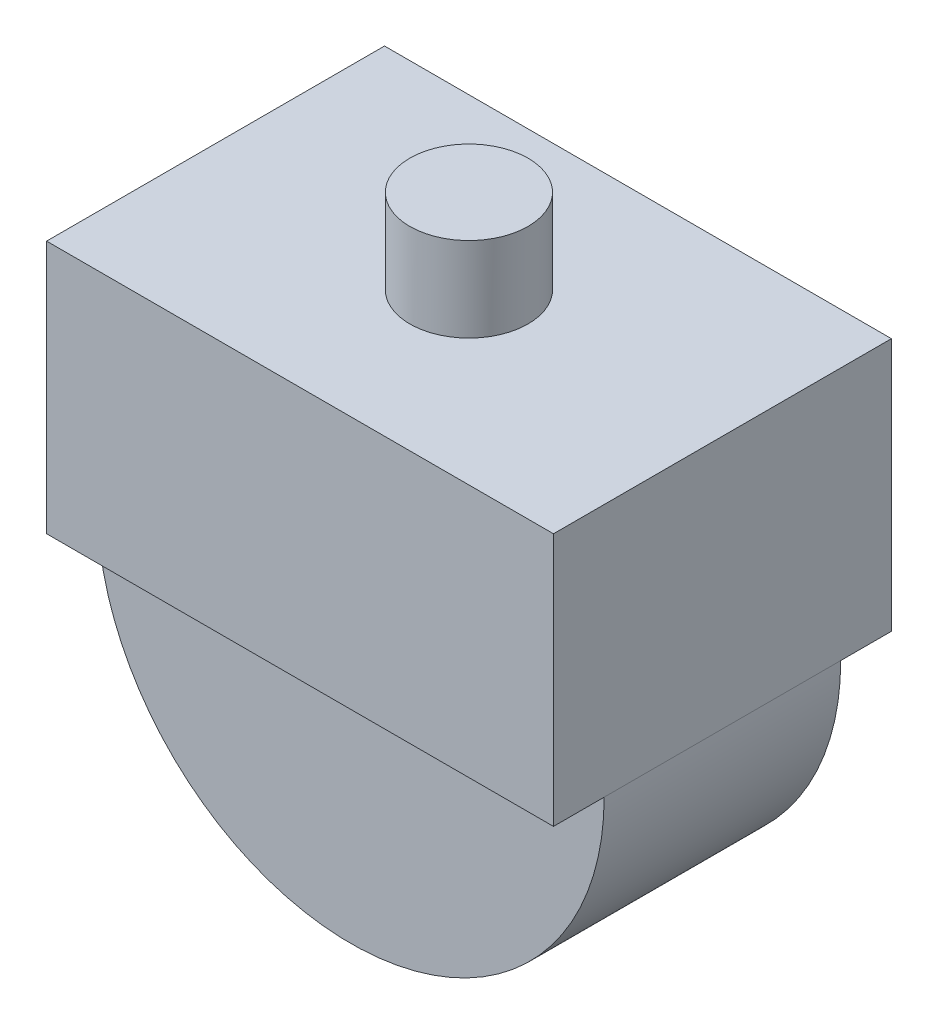
from build123d import *

# Parameters (mm, degrees)
EXTRUSION1_DEPTH        = 14
ESQUISSE2_W             = 30
ESQUISSE2_H             = 15
EXTRUSION2_DEPTH        = 3
ESQUISSE3_W             = 30
ESQUISSE3_H             = 15
EXTRUSION3_DEPTH        = 3
ESQUISSE4_R             = 3.5
EXTRUSION4_DEPTH        = 5
ENL_V_MAT_EXTRU_1_DEPTH = 18


with BuildPart() as part:
    # Esquisse1 → Extrusion1 (new body)
    with BuildSketch(Plane.XY):
        with BuildLine():
            Line((15, 15), (-15, 15))
            Line((-15, 15), (-15, 0))
            ThreePointArc((-15, 0), (0, -15), (15, 0))
            Line((15, 0), (15, 15))
        make_face()
    extrude(amount=EXTRUSION1_DEPTH)

    # Esquisse2 → Extrusion2 (add)
    with BuildSketch(Plane.XY.offset(14)):
        with Locations((0, 7.5)):
            Rectangle(ESQUISSE2_W, ESQUISSE2_H)
    extrude(amount=EXTRUSION2_DEPTH)

    # Esquisse3 → Extrusion3 (add)
    with BuildSketch(Plane(origin=(0, 0, 0), x_dir=(-1, 0, 0), z_dir=(0, 0, -1))):
        with Locations((0, 7.5)):
            Rectangle(ESQUISSE3_W, ESQUISSE3_H)
    extrude(amount=EXTRUSION3_DEPTH)

    # Esquisse4 → Extrusion4 (add)
    with BuildSketch(Plane(origin=(0, 15, 0), x_dir=(1, 0, 0), z_dir=(0, 1, 0))):
        with Locations(Location((-0.004325278, -7, 0), (0, 0, 90))):
            Circle(ESQUISSE4_R)
    extrude(amount=EXTRUSION4_DEPTH)

    # Esquisse5 → Enlèv. mat.-Extru.1 (cut)
    with BuildSketch(Plane.XY.offset(14)):
        with BuildLine():
            Line((-2.992817477, 0), (2.992817477, 0))
            ThreePointArc((2.992817477, 0), (0, -2.992817477), (-2.992817477, 0))
        make_face()
    extrude(amount=-ENL_V_MAT_EXTRU_1_DEPTH, mode=Mode.SUBTRACT)


solid = part.part
